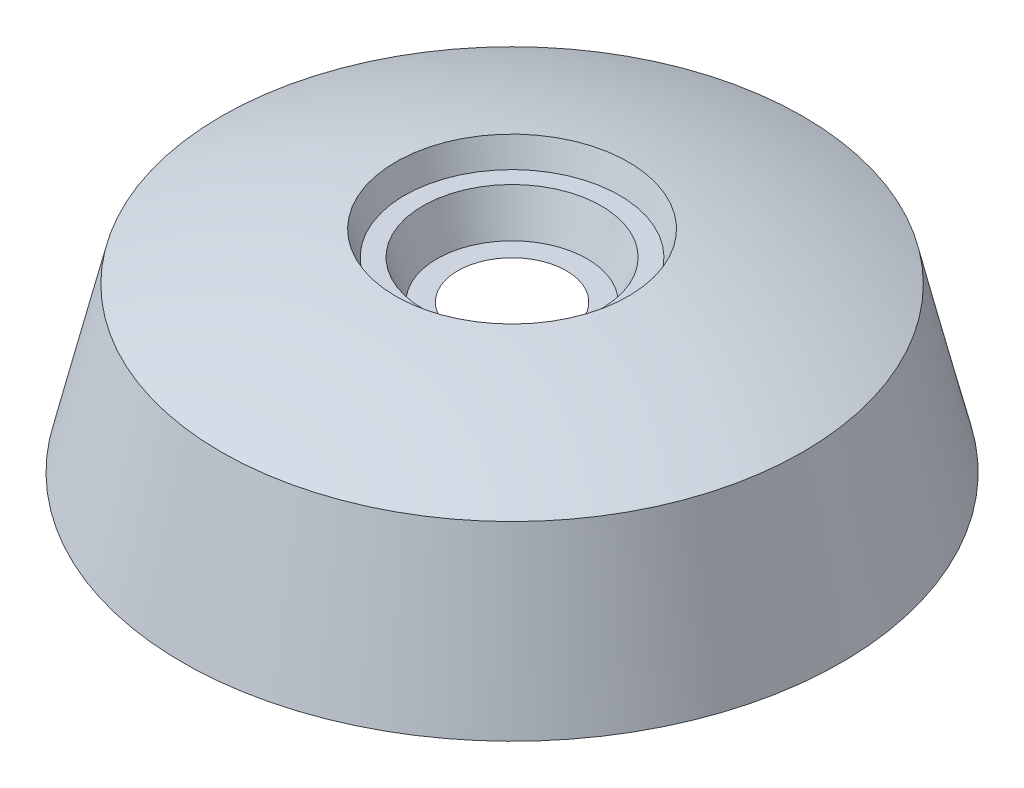
from build123d import *


with BuildPart() as part:
    # Sketch1 → Revolve1 (revolve)
    with BuildSketch(Plane.XY, mode=Mode.PRIVATE) as revolve1_sk:
        with BuildLine():
            Line((-7, 19), (-9.680148829, 19))
            Line((-9.680148829, 19), (-11.5, 24))
            Line((-11.5, 24), (-13.852653517, 24))
            Line((-13.852653517, 24), (-15, 27.152308554))
            ThreePointArc((-15, 27.152308554), (-26.445774227, 24.792132688), (-37.5, 21))
            Line((-37.5, 21), (-42.5, 0))
            Line((-42.5, 0), (-7, 19))
        make_face()
    revolve(revolve1_sk.sketch.rotate(Axis((0, 21.480589669, 0), (0, -1, 0)), 270), axis=Axis((0, 21.480589669, 0), (0, -1, 0)))


solid = part.part
